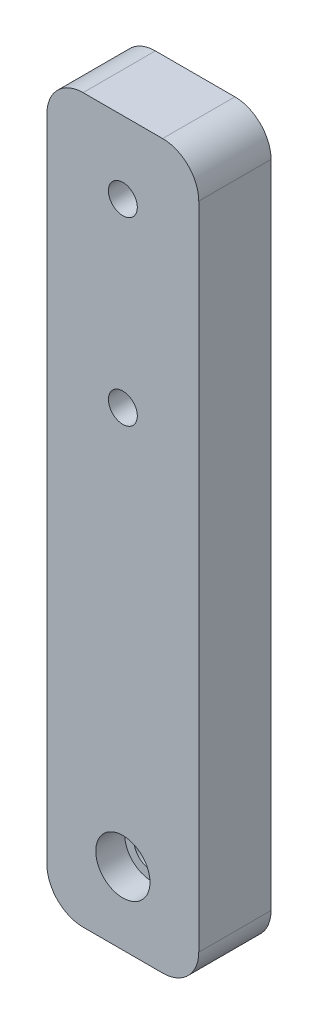
from build123d import *

# Parameters (mm, degrees)
ESQUISSE1_W             = 21
ESQUISSE1_H             = 100
BOSS_EXTRU_1_DEPTH      = 10
ESQUISSE2_R             = 2
ESQUISSE2_R_2           = 2.5
ENL_V_MAT_EXTRU_1_DEPTH = 10
CONG_1_R                = 5
ENL_V_MAT_EXTRU_2_DEPTH = 4
ESQUISSE4_R             = 3.75
ENL_V_MAT_EXTRU_4_DEPTH = 4


with BuildPart() as part:
    # Esquisse1 → Boss.-Extru.1 (new body)
    with BuildSketch(Plane.XY):
        with Locations((2.217198679, -40)):
            Rectangle(ESQUISSE1_W, ESQUISSE1_H)
    extrude(amount=BOSS_EXTRU_1_DEPTH)

    # Esquisse2 → Enlèv. mat.-Extru.1 (cut)
    with BuildSketch(Plane.XY.offset(10)):
        with Locations((2.217198679, 0)):
            Circle(ESQUISSE2_R)
        with Locations((2.217198679, -25)):
            Circle(ESQUISSE2_R)
        with Locations((2.217198679, -80)):
            Circle(ESQUISSE2_R_2)
    extrude(amount=-ENL_V_MAT_EXTRU_1_DEPTH, mode=Mode.SUBTRACT)

    # Congé1
    cong_1_edges = [part.edges().sort_by_distance(p)[0] for p in [
        (-8.282801321, 10, 5),
        (12.717198679, 10, 5),
        (12.717198679, -90, 5),
        (-8.282801321, -90, 5),
    ]]
    fillet(cong_1_edges, radius=CONG_1_R)

    # Esquisse3 → Enlèv. mat.-Extru.2 (cut)
    with BuildSketch(Plane(origin=(0, 0, 0), x_dir=(-1, 0, 0), z_dir=(0, 0, -1))):
        Polygon((-3.80491192, 2.75), (-5.39262516, 0), (-3.80491192, -2.75), (-0.629485439, -2.75), (0.958227801, 0), (-0.629485439, 2.75), align=None)
        Polygon((-3.80491192, -22.25), (-5.39262516, -25), (-3.80491192, -27.75), (-0.629485439, -27.75), (0.958227801, -25), (-0.629485439, -22.25), align=None)
    extrude(amount=-ENL_V_MAT_EXTRU_2_DEPTH, mode=Mode.SUBTRACT)

    # Esquisse4 → Enlèv. mat.-Extru.4 (cut)
    with BuildSketch(Plane.XY.offset(10)):
        with Locations((2.217198679, -80)):
            Circle(ESQUISSE4_R)
    extrude(amount=-ENL_V_MAT_EXTRU_4_DEPTH, mode=Mode.SUBTRACT)


solid = part.part
